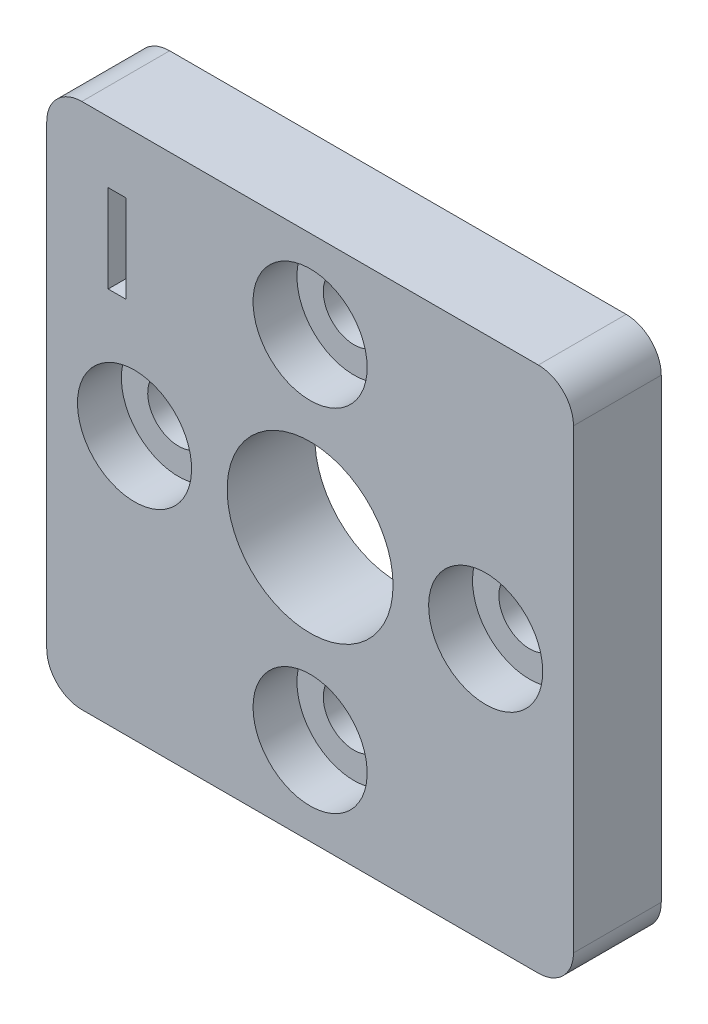
from build123d import *

# Parameters (mm, degrees)
SKETCH1_W           = 30
SKETCH1_H           = 30
SKETCH1_R           = 4.725
BOSS_EXTRUDE1_DEPTH = 5
FILLET1_R           = 2
SKETCH2_R           = 1.75
CUT_EXTRUDE1_DEPTH  = 22.794494718
CIRPATTERN1_COUNT   = 4
SKETCH3_R           = 3.25
CUT_EXTRUDE2_DEPTH  = 2.5
CIRPATTERN2_COUNT   = 4
SKETCH4_W           = 1
SKETCH4_H           = 5
CUT_EXTRUDE3_DEPTH  = 2.5


with BuildPart() as part:
    # Sketch1 → Boss-Extrude1 (new body)
    with BuildSketch(Plane.XY):
        Rectangle(SKETCH1_W, SKETCH1_H)
        Circle(SKETCH1_R, mode=Mode.SUBTRACT)
    extrude(amount=BOSS_EXTRUDE1_DEPTH)

    # Fillet1
    fillet1_edges = [part.edges().sort_by_distance(p)[0] for p in [
        (-15, 15, 2.5),
        (15, 15, 2.5),
        (15, -15, 2.5),
        (-15, -15, 2.5),
    ]]
    fillet(fillet1_edges, radius=FILLET1_R)

    # Sketch2 → Cut-Extrude1 (cut, symmetric)
    with BuildSketch(Plane.XY):
        with Locations((0, 10)):
            Circle(SKETCH2_R)
    cut_extrude1 = extrude(amount=CUT_EXTRUDE1_DEPTH, both=True, mode=Mode.SUBTRACT)

    # CirPattern1: Cut-Extrude1 ×4 about axis
    cirpattern1_axis = Axis((0, 0, 0), (0, 0, 1))
    for i in range(1, CIRPATTERN1_COUNT):
        add(cut_extrude1.rotate(cirpattern1_axis, i * 360 / CIRPATTERN1_COUNT), mode=Mode.SUBTRACT)

    # Sketch3 → Cut-Extrude2 (cut)
    with BuildSketch(Plane.XY.offset(5)):
        with Locations((0, 10)):
            Circle(SKETCH3_R)
    cut_extrude2 = extrude(amount=-CUT_EXTRUDE2_DEPTH, mode=Mode.SUBTRACT)

    # CirPattern2: Cut-Extrude2 ×4 about axis
    cirpattern2_axis = Axis((0, 0, 0), (0, 0, 1))
    for i in range(1, CIRPATTERN2_COUNT):
        add(cut_extrude2.rotate(cirpattern2_axis, i * 360 / CIRPATTERN2_COUNT), mode=Mode.SUBTRACT)

    # Sketch4 → Cut-Extrude3 (cut)
    with BuildSketch(Plane.XY.offset(5)):
        with Locations((-11, 9)):
            Rectangle(SKETCH4_W, SKETCH4_H)
    extrude(amount=-CUT_EXTRUDE3_DEPTH, mode=Mode.SUBTRACT)


solid = part.part
